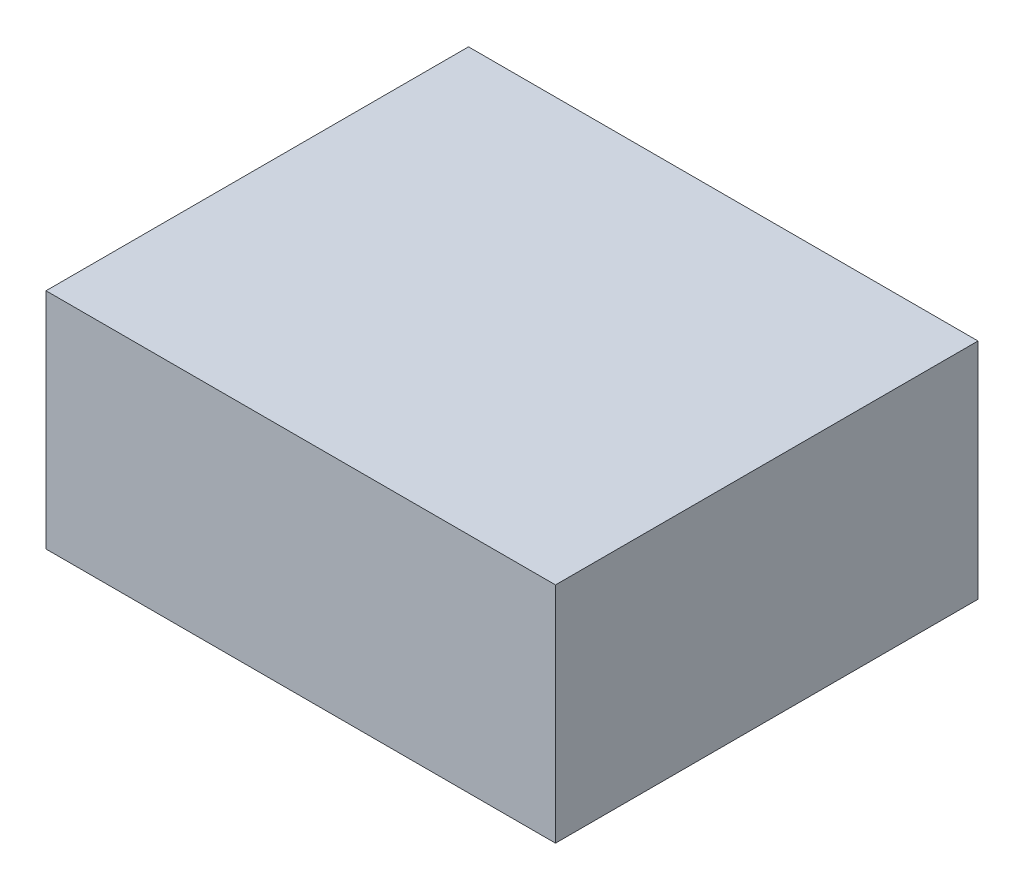
from build123d import *

# Parameters (mm, degrees)
SKETCH1_W           = 4.1
SKETCH1_H           = 3.4
BOSS_EXTRUDE1_DEPTH = 1.8


with BuildPart() as part:
    # Sketch1 → Boss-Extrude1 (new body)
    with BuildSketch(Plane(origin=(0, 0, 0), x_dir=(1, 0, 0), z_dir=(0, 1, 0))):
        with Locations((2.05, 1.7)):
            Rectangle(SKETCH1_W, SKETCH1_H)
    extrude(amount=BOSS_EXTRUDE1_DEPTH)


solid = part.part
